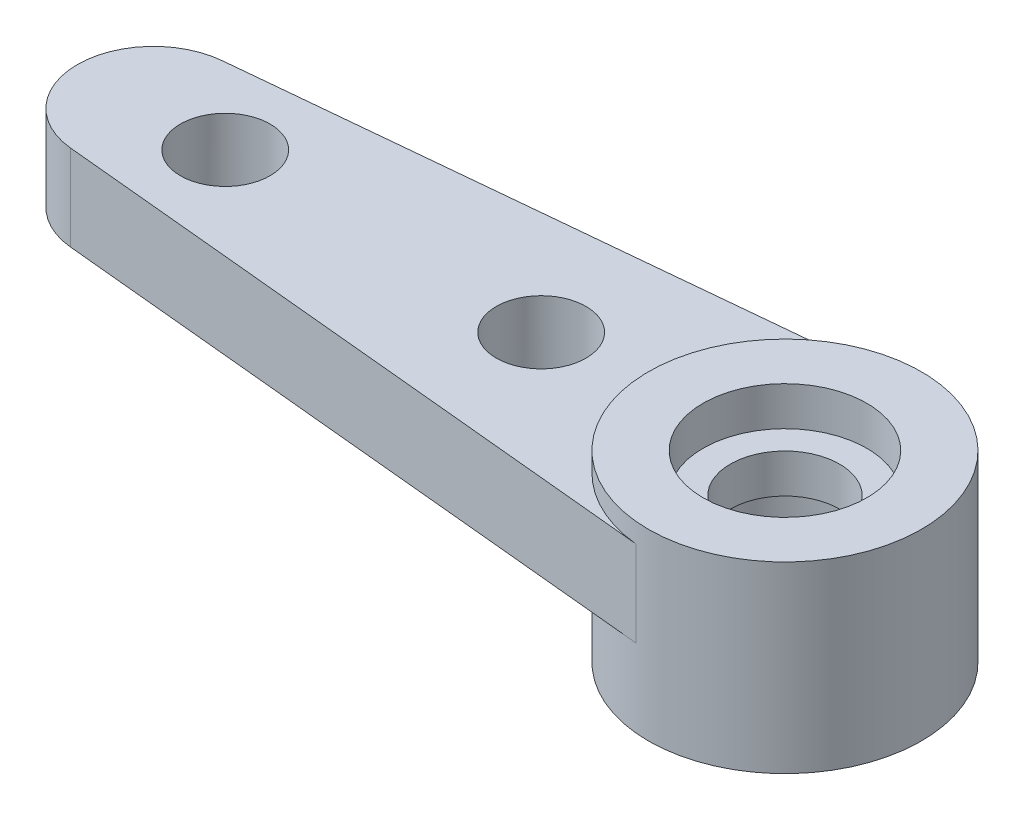
from build123d import *

# Parameters (mm, degrees)
SKETCH1_R           = 3.5
SKETCH1_R_2         = 2.1
BOSS_EXTRUDE1_DEPTH = 4.7
BOSS_EXTRUDE2_START = -2
SKETCH3_R           = 2.1
SKETCH3_R_2         = 1.4
BOSS_EXTRUDE2_DEPTH = 1
BOSS_EXTRUDE3_START = -2.7
BOSS_EXTRUDE3_DEPTH = 2.2
CUT_EXTRUDE1_REACH  = 20.946
SKETCH5_R           = 1.15


with BuildPart() as part:
    # Sketch1 → Boss-Extrude1 (new body)
    with BuildSketch(Plane(origin=(0, 0, 0), x_dir=(1, 0, 0), z_dir=(0, 1, 0))):
        with Locations(Location((0, 0, 0), (0, 0, 270))):
            Circle(SKETCH1_R)
        with Locations(Location((0, 0, 0), (0, 0, 270))):
            Circle(SKETCH1_R_2, mode=Mode.SUBTRACT)
    extrude(amount=BOSS_EXTRUDE1_DEPTH)

    # Sketch3 → Boss-Extrude2 (add)
    with BuildSketch(Plane(origin=(0, 4.7, 0), x_dir=(1, 0, 0), z_dir=(0, 1, 0)).offset(BOSS_EXTRUDE2_START)):
        with Locations(Location((0, 0, 0), (0, 0, 270))):
            Circle(SKETCH3_R)
        with Locations(Location((0, 0, 0), (0, 0, 270))):
            Circle(SKETCH3_R_2, mode=Mode.SUBTRACT)
    extrude(amount=BOSS_EXTRUDE2_DEPTH)

    # Sketch4 → Boss-Extrude3 (add)
    with BuildSketch(Plane(origin=(0, 4.7, 0), x_dir=(1, 0, 0), z_dir=(0, 1, 0)).offset(BOSS_EXTRUDE3_START)):
        with BuildLine():
            Line((-0.335083385, 3.483922951), (-16.376689314, 1.941042787))
            ThreePointArc((-16.376689314, 1.941042787), (-18.14, 0), (-16.376689314, -1.941042787))
            Line((-16.376689314, -1.941042787), (-0.335083385, -3.483922951))
            ThreePointArc((-0.335083385, -3.483922951), (-3.5, 0), (-0.335083385, 3.483922951))
        make_face()
    extrude(amount=BOSS_EXTRUDE3_DEPTH)

    # Sketch5 → Cut-Extrude1 (cut, up to next)
    with BuildSketch(Plane(origin=(0, 4.2, 0), x_dir=(1, 0, 0), z_dir=(0, 1, 0)), mode=Mode.PRIVATE) as cut_extrude1_sk1:
        with Locations(Location((-14.35, 0, 0), (0, 0, 270))):
            Circle(SKETCH5_R)
    cut_extrude1_tool1 = extrude(cut_extrude1_sk1.sketch, amount=-CUT_EXTRUDE1_REACH, mode=Mode.PRIVATE) & part.part
    # Sketch5 → Cut-Extrude1 (cut, up to next)
    with BuildSketch(Plane(origin=(0, 4.2, 0), x_dir=(1, 0, 0), z_dir=(0, 1, 0)), mode=Mode.PRIVATE) as cut_extrude1_sk2:
        with Locations(Location((-6.25, 0, 0), (0, 0, 270))):
            Circle(SKETCH5_R)
    cut_extrude1_tool2 = extrude(cut_extrude1_sk2.sketch, amount=-CUT_EXTRUDE1_REACH, mode=Mode.PRIVATE) & part.part
    add(cut_extrude1_tool1.solids().sort_by_distance((-14.35, 4.2, 0))[0], mode=Mode.SUBTRACT)
    add(cut_extrude1_tool2.solids().sort_by_distance((-6.25, 4.2, 0))[0], mode=Mode.SUBTRACT)


solid = part.part
